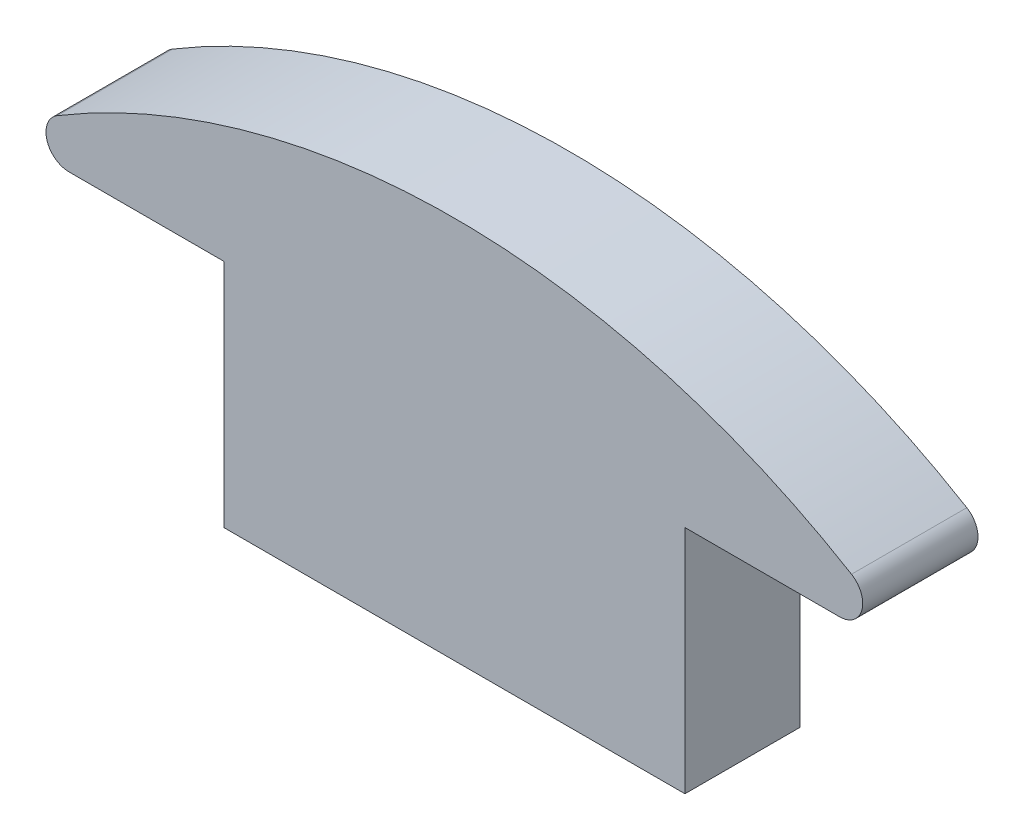
from build123d import *

# Parameters (mm, degrees)
BOSS_EXTRUDE1_DEPTH = 0.5


with BuildPart() as part:
    # Sketch1 → Boss-Extrude1 (new body)
    with BuildSketch(Plane.XY):
        with BuildLine():
            Line((0, 1), (-0.671021001, 1))
            ThreePointArc((-0.671021001, 1), (-0.767398778, 1.07332934), (-0.722430179, 1.185773518))
            ThreePointArc((-0.722430179, 1.185773518), (1, 1.662422298), (2.722430179, 1.185773518))
            ThreePointArc((2.722430179, 1.185773518), (2.767398778, 1.07332934), (2.671021001, 1))
            Line((2.671021001, 1), (2, 1))
            Line((2, 1), (2, 0))
            Line((2, 0), (0, 0))
            Line((0, 0), (0, 1))
        make_face()
    extrude(amount=BOSS_EXTRUDE1_DEPTH)


solid = part.part
